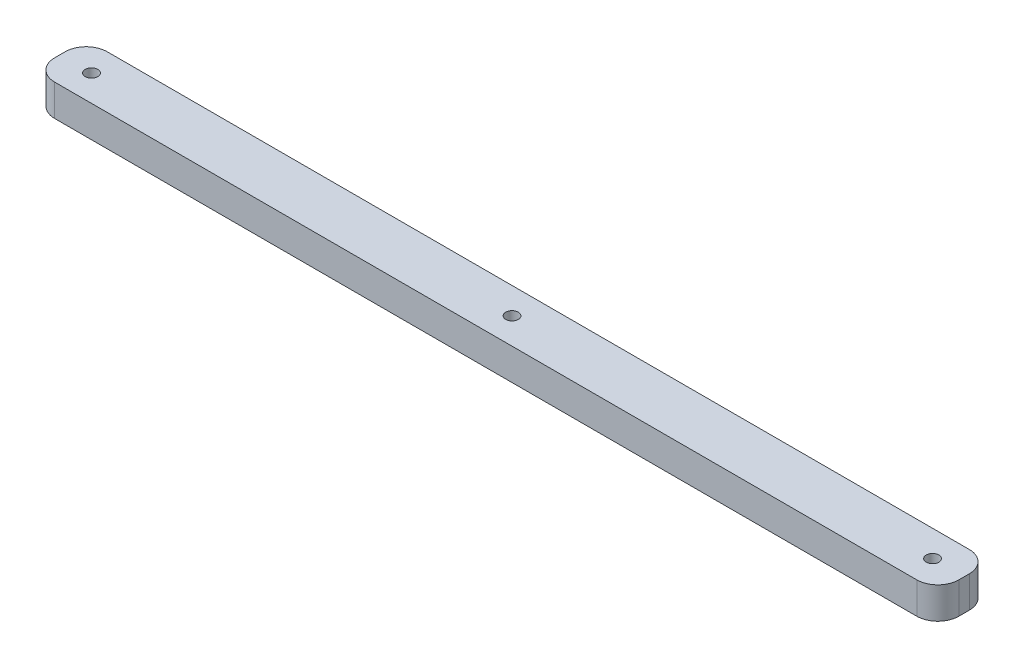
from build123d import *

# Parameters (mm, degrees)
SKETCH1_W           = 86
SKETCH1_H           = 5
SKETCH1_R           = 0.6
BOSS_EXTRUDE1_DEPTH = 3
FILLET1_R           = 2
CUT_EXTRUDE1_REACH  = 88.197
SKETCH3_R           = 0.6


with BuildPart() as part:
    # Sketch1 → Boss-Extrude1 (new body)
    with BuildSketch(Plane(origin=(0, 0, 0), x_dir=(-1, 0, 0), z_dir=(0, -1, 0))):
        with Locations((43, 2.5)):
            Rectangle(SKETCH1_W, SKETCH1_H)
        with Locations(Location((83, 2.5, 0), (0, 0, 90))):
            Circle(SKETCH1_R, mode=Mode.SUBTRACT)
        with Locations(Location((3, 2.5, 0), (0, 0, 90))):
            Circle(SKETCH1_R, mode=Mode.SUBTRACT)
    extrude(amount=BOSS_EXTRUDE1_DEPTH)

    # Fillet1
    fillet1_edges = [part.edges().sort_by_distance(p)[0] for p in [
        (-86, -1.5, 0),
        (0, -1.5, 0),
        (0, -1.5, -5),
        (-86, -1.5, -5),
    ]]
    fillet(fillet1_edges, radius=FILLET1_R)

    # Sketch3 → Cut-Extrude1 (cut, up to next)
    with BuildSketch(Plane.XZ.offset(3), mode=Mode.PRIVATE) as cut_extrude1_sk1:
        with Locations(Location((-43, -2.5, 0), (0, 0, 270))):
            Circle(SKETCH3_R)
    cut_extrude1_tool1 = extrude(cut_extrude1_sk1.sketch, amount=-CUT_EXTRUDE1_REACH, mode=Mode.PRIVATE) & part.part
    add(cut_extrude1_tool1.solids().sort_by_distance((-43, -3, -2.5))[0], mode=Mode.SUBTRACT)


solid = part.part
